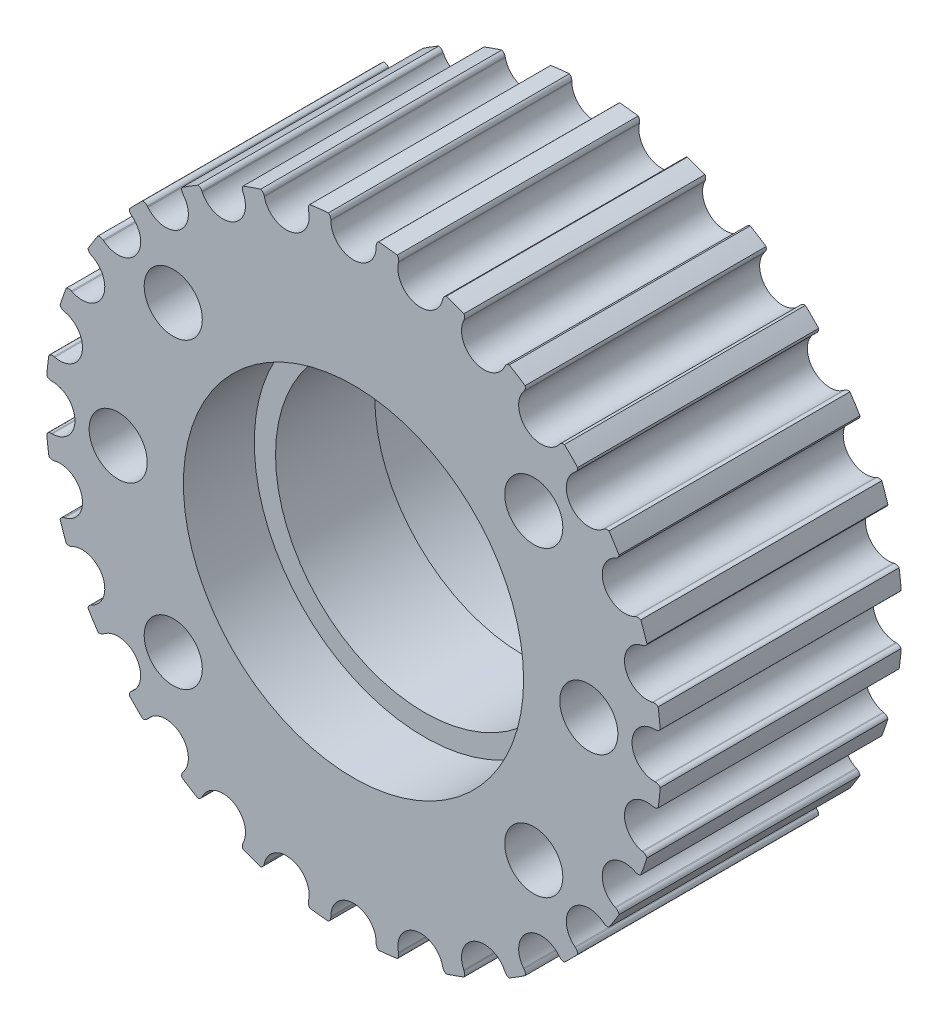
from build123d import *

# Parameters (mm, degrees)
BOSS_EXTRUDE1_DEPTH = 17
SKETCH2_R           = 2.05
SKETCH2_R_2         = 10.5
CUT_EXTRUDE1_DEPTH  = 17
SKETCH2_4_R         = 12
SKETCH2_4_R_2       = 10.5
CUT_EXTRUDE2_DEPTH  = 5
CUT_EXTRUDE3_START  = -12
SKETCH2_5_R         = 2.05
SKETCH2_5_R_2       = 12
SKETCH2_5_R_3       = 10.5
CUT_EXTRUDE3_DEPTH  = 5


with BuildPart() as part:
    # Sketch1 → Boss-Extrude1 (new body)
    with BuildSketch(Plane.XY):
        with BuildLine():
            Line((3.182036443, 21.131747303), (3.168685187, 21.073251628))
            ThreePointArc((3.168685187, 21.073251628), (4.372536352, 19.157333474), (6.288454506, 20.36118464))
            Line((6.288454506, 20.36118464), (6.301805762, 20.419680314))
            ThreePointArc((6.301805762, 20.419680314), (6.386977329, 20.589703223), (6.541037388, 20.701181848))
            ThreePointArc((6.541037388, 20.701181848), (7.170358435, 20.491707101), (7.792986811, 20.263105798))
            ThreePointArc((7.792986811, 20.263105798), (7.843930029, 20.079893424), (7.804512292, 19.893860558))
            Line((7.804512292, 19.893860558), (7.778479268, 19.839802426))
            ThreePointArc((7.778479268, 19.839802426), (8.525815474, 17.704038254), (10.661579645, 18.45137446))
            Line((10.661579645, 18.45137446), (10.687612669, 18.505432592))
            ThreePointArc((10.687612669, 18.505432592), (10.808482464, 18.652240215), (10.983486243, 18.72664225))
            ThreePointArc((10.983486243, 18.72664225), (11.550416381, 18.382382365), (12.106565588, 18.020964726))
            ThreePointArc((12.106565588, 18.020964726), (12.115462965, 17.831009937), (12.035637306, 17.658412574))
            Line((12.035637306, 17.658412574), (11.998227918, 17.611502685))
            ThreePointArc((11.998227918, 17.611502685), (12.251574607, 15.36298863), (14.500088661, 15.616335319))
            Line((14.500088661, 15.616335319), (14.53749805, 15.663245208))
            ThreePointArc((14.53749805, 15.663245208), (14.688005155, 15.779475998), (14.875177234, 15.813070614))
            ThreePointArc((14.875177234, 15.813070614), (15.35128822, 15.35128822), (15.813070614, 14.875177234))
            ThreePointArc((15.813070614, 14.875177234), (15.779475998, 14.688005155), (15.663245208, 14.53749805))
            Line((15.663245208, 14.53749805), (15.616335319, 14.500088661))
            ThreePointArc((15.616335319, 14.500088661), (15.36298863, 12.251574607), (17.611502685, 11.998227918))
            Line((17.611502685, 11.998227918), (17.658412574, 12.035637306))
            ThreePointArc((17.658412574, 12.035637306), (17.831009937, 12.115462965), (18.020964726, 12.106565588))
            ThreePointArc((18.020964726, 12.106565588), (18.382382365, 11.550416381), (18.72664225, 10.983486243))
            ThreePointArc((18.72664225, 10.983486243), (18.652240215, 10.808482464), (18.505432592, 10.687612669))
            Line((18.505432592, 10.687612669), (18.45137446, 10.661579645))
            ThreePointArc((18.45137446, 10.661579645), (17.704038254, 8.525815474), (19.839802426, 7.778479268))
            Line((19.839802426, 7.778479268), (19.893860558, 7.804512292))
            ThreePointArc((19.893860558, 7.804512292), (20.079893424, 7.843930029), (20.263105798, 7.792986811))
            ThreePointArc((20.263105798, 7.792986811), (20.491707101, 7.170358435), (20.701181848, 6.541037388))
            ThreePointArc((20.701181848, 6.541037388), (20.589703223, 6.386977329), (20.419680314, 6.301805762))
            Line((20.419680314, 6.301805762), (20.36118464, 6.288454506))
            ThreePointArc((20.36118464, 6.288454506), (19.157333474, 4.372536352), (21.073251628, 3.168685187))
            Line((21.073251628, 3.168685187), (21.131747303, 3.182036443))
            ThreePointArc((21.131747303, 3.182036443), (21.321887209, 3.179069688), (21.489170133, 3.088635134))
            ThreePointArc((21.489170133, 3.088635134), (21.573492077, 2.430748776), (21.637677747, 1.770593605))
            ThreePointArc((21.637677747, 1.770593605), (21.494712536, 1.645202482), (21.31, 1.6))
            Line((21.31, 1.6), (21.25, 1.6))
            ThreePointArc((21.25, 1.6), (19.65, 0), (21.25, -1.6))
            Line((21.25, -1.6), (21.31, -1.6))
            ThreePointArc((21.31, -1.6), (21.494712536, -1.645202482), (21.637677747, -1.770593605))
            ThreePointArc((21.637677747, -1.770593605), (21.573492077, -2.430748776), (21.489170133, -3.088635134))
            ThreePointArc((21.489170133, -3.088635134), (21.321887209, -3.179069688), (21.131747303, -3.182036443))
            Line((21.131747303, -3.182036443), (21.073251628, -3.168685187))
            ThreePointArc((21.073251628, -3.168685187), (19.157333474, -4.372536352), (20.36118464, -6.288454506))
            Line((20.36118464, -6.288454506), (20.419680314, -6.301805762))
            ThreePointArc((20.419680314, -6.301805762), (20.589703223, -6.386977329), (20.701181848, -6.541037388))
            ThreePointArc((20.701181848, -6.541037388), (20.491707101, -7.170358435), (20.263105798, -7.792986811))
            ThreePointArc((20.263105798, -7.792986811), (20.079893424, -7.843930029), (19.893860558, -7.804512292))
            Line((19.893860558, -7.804512292), (19.839802426, -7.778479268))
            ThreePointArc((19.839802426, -7.778479268), (17.704038254, -8.525815474), (18.45137446, -10.661579645))
            Line((18.45137446, -10.661579645), (18.505432592, -10.687612669))
            ThreePointArc((18.505432592, -10.687612669), (18.652240215, -10.808482464), (18.72664225, -10.983486243))
            ThreePointArc((18.72664225, -10.983486243), (18.382382365, -11.550416381), (18.020964726, -12.106565588))
            ThreePointArc((18.020964726, -12.106565588), (17.831009937, -12.115462965), (17.658412574, -12.035637306))
            Line((17.658412574, -12.035637306), (17.611502685, -11.998227918))
            ThreePointArc((17.611502685, -11.998227918), (15.36298863, -12.251574607), (15.616335319, -14.500088661))
            Line((15.616335319, -14.500088661), (15.663245208, -14.53749805))
            ThreePointArc((15.663245208, -14.53749805), (15.779475998, -14.688005155), (15.813070614, -14.875177234))
            ThreePointArc((15.813070614, -14.875177234), (15.35128822, -15.35128822), (14.875177234, -15.813070614))
            ThreePointArc((14.875177234, -15.813070614), (14.688005155, -15.779475998), (14.53749805, -15.663245208))
            Line((14.53749805, -15.663245208), (14.500088661, -15.616335319))
            ThreePointArc((14.500088661, -15.616335319), (12.251574607, -15.36298863), (11.998227918, -17.611502685))
            Line((11.998227918, -17.611502685), (12.035637306, -17.658412574))
            ThreePointArc((12.035637306, -17.658412574), (12.115462965, -17.831009937), (12.106565588, -18.020964726))
            ThreePointArc((12.106565588, -18.020964726), (11.550416381, -18.382382365), (10.983486243, -18.72664225))
            ThreePointArc((10.983486243, -18.72664225), (10.808482464, -18.652240215), (10.687612669, -18.505432592))
            Line((10.687612669, -18.505432592), (10.661579645, -18.45137446))
            ThreePointArc((10.661579645, -18.45137446), (8.525815474, -17.704038254), (7.778479268, -19.839802426))
            Line((7.778479268, -19.839802426), (7.804512292, -19.893860558))
            ThreePointArc((7.804512292, -19.893860558), (7.843930029, -20.079893424), (7.792986811, -20.263105798))
            ThreePointArc((7.792986811, -20.263105798), (7.170358435, -20.491707101), (6.541037388, -20.701181848))
            ThreePointArc((6.541037388, -20.701181848), (6.386977329, -20.589703223), (6.301805762, -20.419680314))
            Line((6.301805762, -20.419680314), (6.288454506, -20.36118464))
            ThreePointArc((6.288454506, -20.36118464), (4.372536352, -19.157333474), (3.168685187, -21.073251628))
            Line((3.168685187, -21.073251628), (3.182036443, -21.131747303))
            ThreePointArc((3.182036443, -21.131747303), (3.179069688, -21.321887209), (3.088635134, -21.489170133))
            ThreePointArc((3.088635134, -21.489170133), (2.430748776, -21.573492077), (1.770593605, -21.637677747))
            ThreePointArc((1.770593605, -21.637677747), (1.645202482, -21.494712536), (1.6, -21.31))
            Line((1.6, -21.31), (1.6, -21.25))
            ThreePointArc((1.6, -21.25), (0, -19.65), (-1.6, -21.25))
            Line((-1.6, -21.25), (-1.6, -21.31))
            ThreePointArc((-1.6, -21.31), (-1.645202482, -21.494712536), (-1.770593605, -21.637677747))
            ThreePointArc((-1.770593605, -21.637677747), (-2.430748776, -21.573492077), (-3.088635134, -21.489170133))
            ThreePointArc((-3.088635134, -21.489170133), (-3.179069688, -21.321887209), (-3.182036443, -21.131747303))
            Line((-3.182036443, -21.131747303), (-3.168685187, -21.073251628))
            ThreePointArc((-3.168685187, -21.073251628), (-4.372536352, -19.157333474), (-6.288454506, -20.36118464))
            Line((-6.288454506, -20.36118464), (-6.301805762, -20.419680314))
            ThreePointArc((-6.301805762, -20.419680314), (-6.386977329, -20.589703223), (-6.541037388, -20.701181848))
            ThreePointArc((-6.541037388, -20.701181848), (-7.170358435, -20.491707101), (-7.792986811, -20.263105798))
            ThreePointArc((-7.792986811, -20.263105798), (-7.843930029, -20.079893424), (-7.804512292, -19.893860558))
            Line((-7.804512292, -19.893860558), (-7.778479268, -19.839802426))
            ThreePointArc((-7.778479268, -19.839802426), (-8.525815474, -17.704038254), (-10.661579645, -18.45137446))
            Line((-10.661579645, -18.45137446), (-10.687612669, -18.505432592))
            ThreePointArc((-10.687612669, -18.505432592), (-10.808482464, -18.652240215), (-10.983486243, -18.72664225))
            ThreePointArc((-10.983486243, -18.72664225), (-11.550416381, -18.382382365), (-12.106565588, -18.020964726))
            ThreePointArc((-12.106565588, -18.020964726), (-12.115462965, -17.831009937), (-12.035637306, -17.658412574))
            Line((-12.035637306, -17.658412574), (-11.998227918, -17.611502685))
            ThreePointArc((-11.998227918, -17.611502685), (-12.251574607, -15.36298863), (-14.500088661, -15.616335319))
            Line((-14.500088661, -15.616335319), (-14.53749805, -15.663245208))
            ThreePointArc((-14.53749805, -15.663245208), (-14.688005155, -15.779475998), (-14.875177234, -15.813070614))
            ThreePointArc((-14.875177234, -15.813070614), (-15.35128822, -15.35128822), (-15.813070614, -14.875177234))
            ThreePointArc((-15.813070614, -14.875177234), (-15.779475998, -14.688005155), (-15.663245208, -14.53749805))
            Line((-15.663245208, -14.53749805), (-15.616335319, -14.500088661))
            ThreePointArc((-15.616335319, -14.500088661), (-15.36298863, -12.251574607), (-17.611502685, -11.998227918))
            Line((-17.611502685, -11.998227918), (-17.658412574, -12.035637306))
            ThreePointArc((-17.658412574, -12.035637306), (-17.831009937, -12.115462965), (-18.020964726, -12.106565588))
            ThreePointArc((-18.020964726, -12.106565588), (-18.382382365, -11.550416381), (-18.72664225, -10.983486243))
            ThreePointArc((-18.72664225, -10.983486243), (-18.652240215, -10.808482464), (-18.505432592, -10.687612669))
            Line((-18.505432592, -10.687612669), (-18.45137446, -10.661579645))
            ThreePointArc((-18.45137446, -10.661579645), (-17.704038254, -8.525815474), (-19.839802426, -7.778479268))
            Line((-19.839802426, -7.778479268), (-19.893860558, -7.804512292))
            ThreePointArc((-19.893860558, -7.804512292), (-20.079893424, -7.843930029), (-20.263105798, -7.792986811))
            ThreePointArc((-20.263105798, -7.792986811), (-20.491707101, -7.170358435), (-20.701181848, -6.541037388))
            ThreePointArc((-20.701181848, -6.541037388), (-20.589703223, -6.386977329), (-20.419680314, -6.301805762))
            Line((-20.419680314, -6.301805762), (-20.36118464, -6.288454506))
            ThreePointArc((-20.36118464, -6.288454506), (-19.157333474, -4.372536352), (-21.073251628, -3.168685187))
            Line((-21.073251628, -3.168685187), (-21.131747303, -3.182036443))
            ThreePointArc((-21.131747303, -3.182036443), (-21.321887209, -3.179069688), (-21.489170133, -3.088635134))
            ThreePointArc((-21.489170133, -3.088635134), (-21.573492077, -2.430748776), (-21.637677747, -1.770593605))
            ThreePointArc((-21.637677747, -1.770593605), (-21.494712536, -1.645202482), (-21.31, -1.6))
            Line((-21.31, -1.6), (-21.25, -1.6))
            ThreePointArc((-21.25, -1.6), (-19.65, 0), (-21.25, 1.6))
            Line((-21.25, 1.6), (-21.31, 1.6))
            ThreePointArc((-21.31, 1.6), (-21.494712536, 1.645202482), (-21.637677747, 1.770593605))
            ThreePointArc((-21.637677747, 1.770593605), (-21.573492077, 2.430748776), (-21.489170133, 3.088635134))
            ThreePointArc((-21.489170133, 3.088635134), (-21.321887209, 3.179069688), (-21.131747303, 3.182036443))
            Line((-21.131747303, 3.182036443), (-21.073251628, 3.168685187))
            ThreePointArc((-21.073251628, 3.168685187), (-19.157333474, 4.372536352), (-20.36118464, 6.288454506))
            Line((-20.36118464, 6.288454506), (-20.419680314, 6.301805762))
            ThreePointArc((-20.419680314, 6.301805762), (-20.589703223, 6.386977329), (-20.701181848, 6.541037388))
            ThreePointArc((-20.701181848, 6.541037388), (-20.491707101, 7.170358435), (-20.263105798, 7.792986811))
            ThreePointArc((-20.263105798, 7.792986811), (-20.079893424, 7.843930029), (-19.893860558, 7.804512292))
            Line((-19.893860558, 7.804512292), (-19.839802426, 7.778479268))
            ThreePointArc((-19.839802426, 7.778479268), (-17.704038254, 8.525815474), (-18.45137446, 10.661579645))
            Line((-18.45137446, 10.661579645), (-18.505432592, 10.687612669))
            ThreePointArc((-18.505432592, 10.687612669), (-18.652240215, 10.808482464), (-18.72664225, 10.983486243))
            ThreePointArc((-18.72664225, 10.983486243), (-18.382382365, 11.550416381), (-18.020964726, 12.106565588))
            ThreePointArc((-18.020964726, 12.106565588), (-17.831009937, 12.115462965), (-17.658412574, 12.035637306))
            Line((-17.658412574, 12.035637306), (-17.611502685, 11.998227918))
            ThreePointArc((-17.611502685, 11.998227918), (-15.36298863, 12.251574607), (-15.616335319, 14.500088661))
            Line((-15.616335319, 14.500088661), (-15.663245208, 14.53749805))
            ThreePointArc((-15.663245208, 14.53749805), (-15.779475998, 14.688005155), (-15.813070614, 14.875177234))
            ThreePointArc((-15.813070614, 14.875177234), (-15.35128822, 15.35128822), (-14.875177234, 15.813070614))
            ThreePointArc((-14.875177234, 15.813070614), (-14.688005155, 15.779475998), (-14.53749805, 15.663245208))
            Line((-14.53749805, 15.663245208), (-14.500088661, 15.616335319))
            ThreePointArc((-14.500088661, 15.616335319), (-12.251574607, 15.36298863), (-11.998227918, 17.611502685))
            Line((-11.998227918, 17.611502685), (-12.035637306, 17.658412574))
            ThreePointArc((-12.035637306, 17.658412574), (-12.115462965, 17.831009937), (-12.106565588, 18.020964726))
            ThreePointArc((-12.106565588, 18.020964726), (-11.550416381, 18.382382365), (-10.983486243, 18.72664225))
            ThreePointArc((-10.983486243, 18.72664225), (-10.808482464, 18.652240215), (-10.687612669, 18.505432592))
            Line((-10.687612669, 18.505432592), (-10.661579645, 18.45137446))
            ThreePointArc((-10.661579645, 18.45137446), (-8.525815474, 17.704038254), (-7.778479268, 19.839802426))
            Line((-7.778479268, 19.839802426), (-7.804512292, 19.893860558))
            ThreePointArc((-7.804512292, 19.893860558), (-7.843930029, 20.079893424), (-7.792986811, 20.263105798))
            ThreePointArc((-7.792986811, 20.263105798), (-7.170358435, 20.491707101), (-6.541037388, 20.701181848))
            ThreePointArc((-6.541037388, 20.701181848), (-6.386977329, 20.589703223), (-6.301805762, 20.419680314))
            Line((-6.301805762, 20.419680314), (-6.288454506, 20.36118464))
            ThreePointArc((-6.288454506, 20.36118464), (-4.372536352, 19.157333474), (-3.168685187, 21.073251628))
            Line((-3.168685187, 21.073251628), (-3.182036443, 21.131747303))
            ThreePointArc((-3.182036443, 21.131747303), (-3.179069688, 21.321887209), (-3.088635134, 21.489170133))
            ThreePointArc((-3.088635134, 21.489170133), (-2.430748776, 21.573492077), (-1.770593605, 21.637677747))
            ThreePointArc((-1.770593605, 21.637677747), (-1.645202482, 21.494712536), (-1.6, 21.31))
            Line((-1.6, 21.31), (-1.6, 21.25))
            ThreePointArc((-1.6, 21.25), (0, 19.65), (1.6, 21.25))
            Line((1.6, 21.25), (1.6, 21.31))
            ThreePointArc((1.6, 21.31), (1.645202482, 21.494712536), (1.770593605, 21.637677747))
            ThreePointArc((1.770593605, 21.637677747), (2.430748776, 21.573492077), (3.088635134, 21.489170133))
            ThreePointArc((3.088635134, 21.489170133), (3.179069688, 21.321887209), (3.182036443, 21.131747303))
        make_face()
    extrude(amount=BOSS_EXTRUDE1_DEPTH)

    # Sketch2 → Cut-Extrude1 (cut)
    with BuildSketch(Plane(origin=(0, 0, 0), x_dir=(-1, 0, 0), z_dir=(0, 0, -1))):
        with Locations((12.716337756, 10.670274321)):
            Circle(SKETCH2_R)
        with Locations((16.6, 0)):
            Circle(SKETCH2_R)
        with Locations((12.716337756, -10.670274321)):
            Circle(SKETCH2_R)
        Circle(SKETCH2_R_2)
    cut_extrude1 = extrude(amount=-CUT_EXTRUDE1_DEPTH, mode=Mode.SUBTRACT)

    # Sketch2<4> → Cut-Extrude2 (cut)
    with BuildSketch(Plane(origin=(0, 0, 0), x_dir=(-1, 0, 0), z_dir=(0, 0, -1))):
        Circle(SKETCH2_4_R)
        Circle(SKETCH2_4_R_2, mode=Mode.SUBTRACT)
    extrude(amount=-CUT_EXTRUDE2_DEPTH, mode=Mode.SUBTRACT)

    # Sketch2<5> → Cut-Extrude3 (cut)
    # profile 1 of 4: a face of its own
    with BuildSketch(Plane(origin=(0, 0, 0), x_dir=(-1, 0, 0), z_dir=(0, 0, -1)).offset(CUT_EXTRUDE3_START)):
        with Locations((16.6, 0)):
            Circle(SKETCH2_5_R)
    # profile 2 of 4: a face of its own
    with BuildSketch(Plane(origin=(0, 0, 0), x_dir=(-1, 0, 0), z_dir=(0, 0, -1)).offset(CUT_EXTRUDE3_START)):
        with Locations((12.716337756, 10.670274321)):
            Circle(SKETCH2_5_R)
    # profile 3 of 4: a face of its own
    with BuildSketch(Plane(origin=(0, 0, 0), x_dir=(-1, 0, 0), z_dir=(0, 0, -1)).offset(CUT_EXTRUDE3_START)):
        with Locations((12.716337756, -10.670274321)):
            Circle(SKETCH2_5_R)
    # profile 4 of 4: a face of its own
    with BuildSketch(Plane(origin=(0, 0, 0), x_dir=(-1, 0, 0), z_dir=(0, 0, -1)).offset(CUT_EXTRUDE3_START)):
        Circle(SKETCH2_5_R_2)
        Circle(SKETCH2_5_R_3, mode=Mode.SUBTRACT)
    extrude(amount=-CUT_EXTRUDE3_DEPTH, mode=Mode.SUBTRACT)

    # Mirror1: Cut-Extrude1 across plane
    add(cut_extrude1.mirror(Plane(origin=(0, 0, 0), x_dir=(0, 0, 1), z_dir=(1, 0, 0))), mode=Mode.SUBTRACT)


solid = part.part
